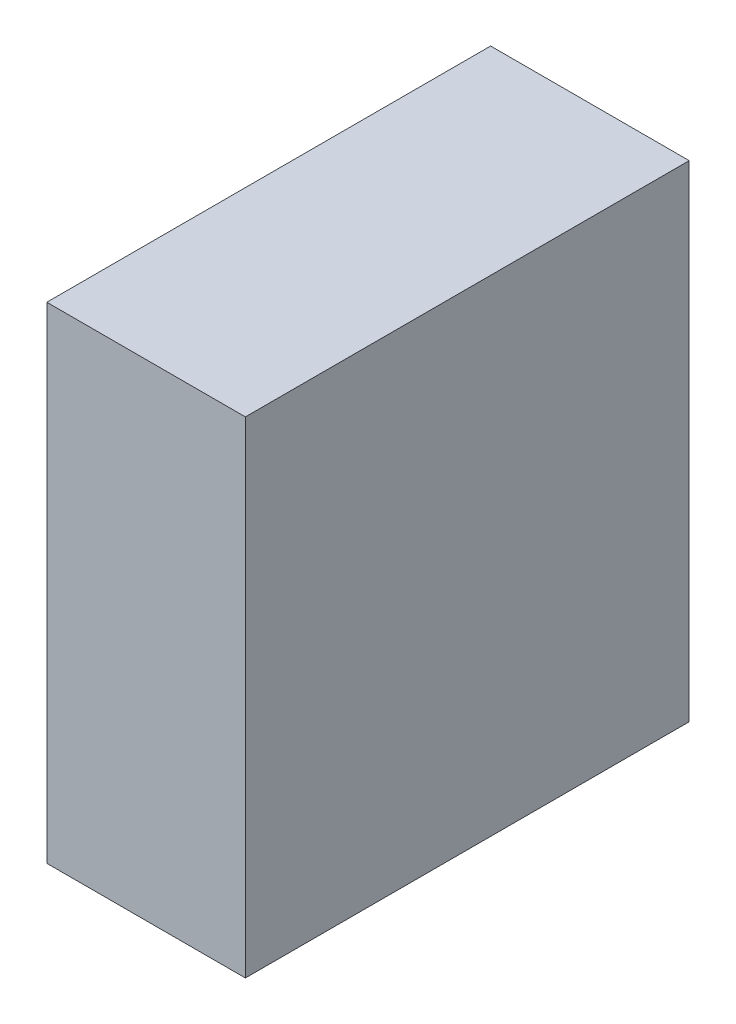
from build123d import *

# Parameters (mm, degrees)
SKETCH1_W           = 613
SKETCH1_H           = 1370
BOSS_EXTRUDE1_DEPTH = 1500


with BuildPart() as part:
    # Sketch1 → Boss-Extrude1 (new body)
    with BuildSketch(Plane(origin=(0, 0, 0), x_dir=(1, 0, 0), z_dir=(0, 1, 0))):
        with Locations((306.5, 685)):
            Rectangle(SKETCH1_W, SKETCH1_H)
    extrude(amount=BOSS_EXTRUDE1_DEPTH)


solid = part.part
